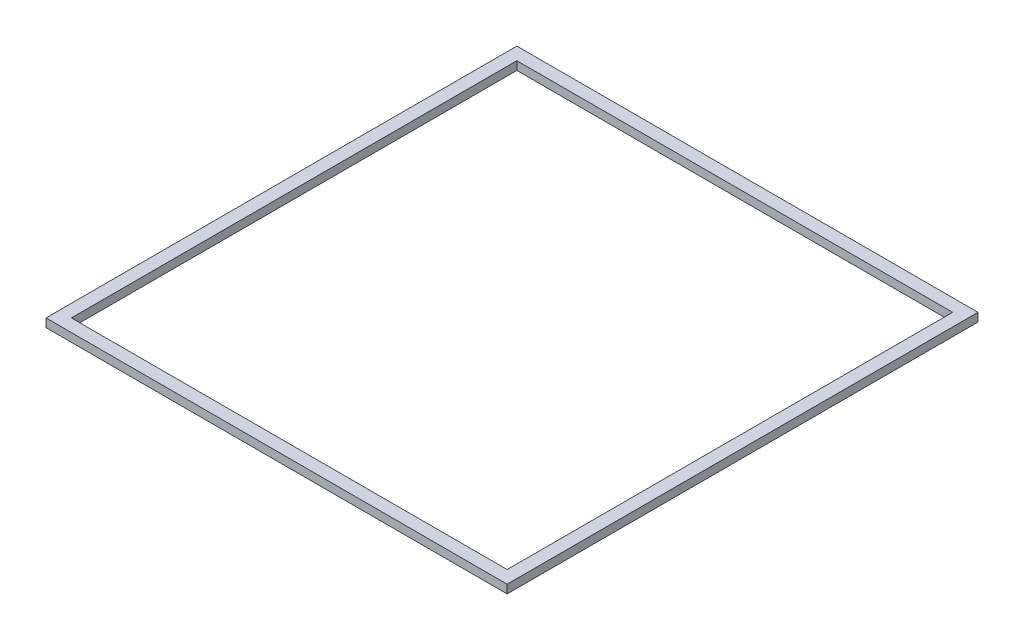
from build123d import *

# Parameters (mm, degrees)
SKETCH1_W           = 86.5875
SKETCH1_H           = 88.4125
SKETCH1_W_2         = 81.825
SKETCH1_H_2         = 83.65
BOSS_EXTRUDE1_DEPTH = 1.5875


with BuildPart() as part:
    # Sketch1 → Boss-Extrude1 (new body)
    with BuildSketch(Plane(origin=(0, 0, 0), x_dir=(1, 0, 0), z_dir=(0, 1, 0))):
        with Locations((43.29375, 44.20625)):
            Rectangle(SKETCH1_W, SKETCH1_H)
        with Locations((43.29375, 44.20625)):
            Rectangle(SKETCH1_W_2, SKETCH1_H_2, mode=Mode.SUBTRACT)
    extrude(amount=BOSS_EXTRUDE1_DEPTH)


solid = part.part
